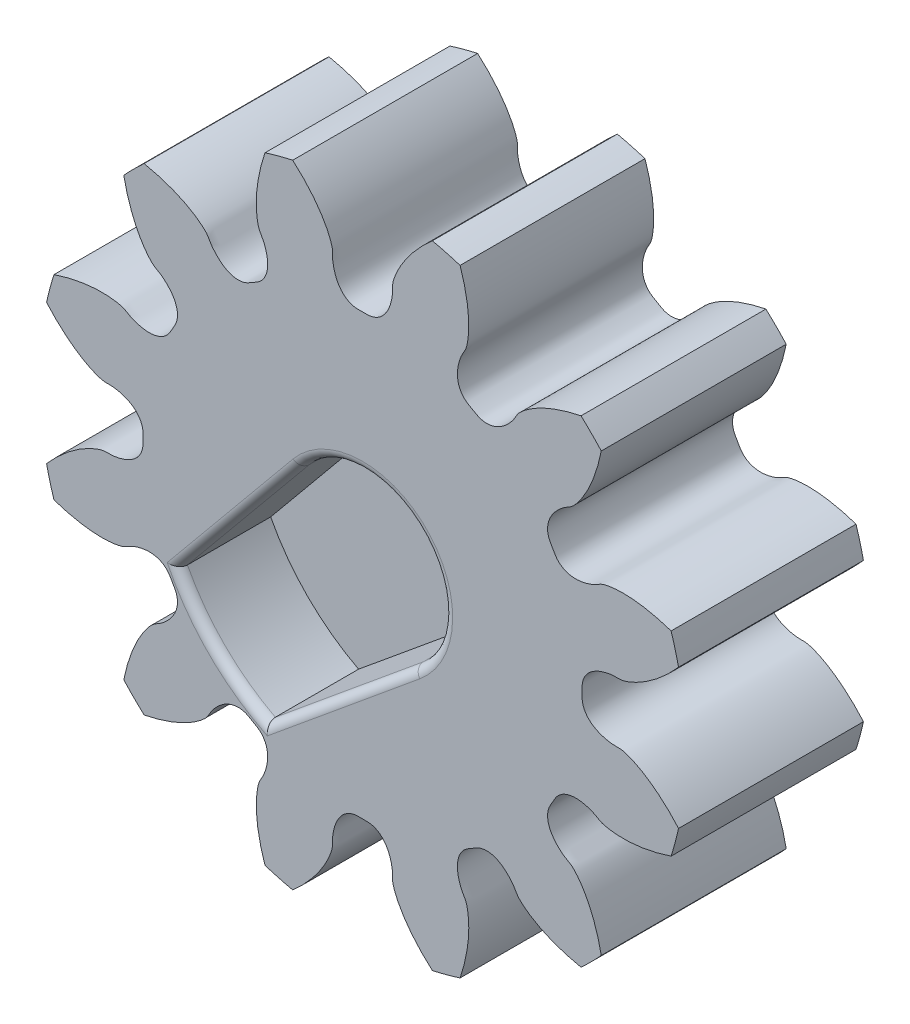
from build123d import *

# Parameters (mm, degrees)
SKETCH_233_W               = 20
SKETCH_233_H               = 13.99999979
CUT_EXTRUDE_402_DEPTH      = 10
PATTERN_CIRCULAR_454_COUNT = 12
CUT_EXTRUDE_1_DEPTH        = 4
SKETCH_2_R                 = 22.983710015
CUT_EXTRUDE_2_DEPTH        = 12
SKETCH_3_R                 = 1
CUT_EXTRUDE_3_DEPTH        = 8
FILLET_1_R                 = 0.4
CUT_EXTRUDE_START          = -1
SKETCH_4_R                 = 3.5
CUT_EXTRUDE_4_DEPTH        = 1


with BuildPart() as part:
    # Sketch 233 → Revolve 260 (revolve)
    with BuildSketch(Plane(origin=(0, 0, 0), x_dir=(0, 0, -1), z_dir=(1, 0, 0)), mode=Mode.PRIVATE) as revolve_260_sk:
        with Locations((0, 6.999999895)):
            Rectangle(SKETCH_233_W, SKETCH_233_H)
    revolve(revolve_260_sk.sketch.rotate(Axis((0, 0, 0), (0, 0, -1)), 90), axis=Axis((0, 0, 0), (0, 0, -1)))

    # Sketch 307 → Cut-Extrude 402 (cut, symmetric)
    with BuildSketch(Plane.XY):
        with BuildLine():
            ThreePointArc((13.751672343, 3.114723392), (14.099999788, 0), (13.751672343, -3.114723392))
            add(Edge.make_bspline(
                [(13.751672343, -3.114723392), (13.621405594, -2.961366383), (13.423168665, -2.744099109), (13.150302893, -2.477714686), (12.955973065, -2.301738692), (12.767351865, -2.143387522), (12.585471133, -2.001970796), (12.411318432, -1.87674583), (12.245834563, -1.766920222), (12.089911307, -1.671655204), (11.944389115, -1.590064993), (11.81005545, -1.521230069), (11.687641583, -1.464165948), (11.577824803, -1.41793324), (11.481214394, -1.381309823), (11.368401777, -1.343822941), (11.139285425, -1.276740863), (10.893805917, -1.309567257), (10.679613247, -1.275365686), (10.5857322, -1.258383462), (10.494653994, -1.237600603), (10.406289124, -1.213539659), (10.320617301, -1.185967837), (10.237597526, -1.154794968), (10.157199405, -1.119828447), (10.079407666, -1.080824203), (10.004240522, -1.037460106), (9.931773934, -0.989331575), (9.862176927, -0.935947305), (9.795758995, -0.876738068), (9.733030125, -0.811086036), (9.674765443, -0.73838774), (9.622069009, -0.658162114), (9.576371784, -0.570212963), (9.539468558, -0.474816546), (9.51299326, -0.37294559), (9.500903465, -0.277168158), (9.495960574, -0.152429996), (9.502886425, 0), (9.495960574, 0.152429996), (9.500903465, 0.277168158), (9.51299326, 0.37294559), (9.539468558, 0.474816546), (9.576371784, 0.570212963), (9.622069009, 0.658162114), (9.674765443, 0.73838774), (9.733030125, 0.811086036), (9.795758995, 0.876738068), (9.862176927, 0.935947305), (9.931773934, 0.989331575), (10.004240522, 1.037460106), (10.079407666, 1.080824203), (10.157199405, 1.119828447), (10.237597526, 1.154794968), (10.320617301, 1.185967837), (10.406289124, 1.213539659), (10.494653994, 1.237600603), (10.5857322, 1.258383462), (10.679613247, 1.275365686), (10.893805917, 1.309567257), (11.139285425, 1.276740863), (11.368401777, 1.343822941), (11.481214394, 1.381309823), (11.577824803, 1.41793324), (11.687641583, 1.464165948), (11.81005545, 1.521230069), (11.944389115, 1.590064993), (12.089911307, 1.671655204), (12.245834563, 1.766920222), (12.411318432, 1.87674583), (12.585471133, 2.001970796), (12.767351865, 2.143387522), (12.955973065, 2.301738692), (13.150302893, 2.477714686), (13.423168665, 2.744099109), (13.621405594, 2.961366383), (13.751672343, 3.114723392)],
                knots=[0, 0, 0, 0, 0.053498046, 0.078135304, 0.101364719, 0.123186291, 0.143600019, 0.162605904, 0.180203946, 0.196394145, 0.2111765, 0.224551012, 0.236517681, 0.247076507, 0.256227489, 0.263970629, 0.278715542, 0.319236256, 0.327882554, 0.336333023, 0.34460309, 0.352710549, 0.36067594, 0.368522978, 0.376279002, 0.383975421, 0.391648082, 0.399337459, 0.407088481, 0.414949717, 0.422971564, 0.431202994, 0.439686492, 0.44845116, 0.457504745, 0.466826485, 0.47636373, 0.483108959, 0.5, 0.516891041, 0.52363627, 0.533173515, 0.542495255, 0.55154884, 0.560313508, 0.568797006, 0.577028436, 0.585050283, 0.592911519, 0.600662541, 0.608351918, 0.616024579, 0.623720998, 0.631477022, 0.63932406, 0.647289451, 0.65539691, 0.663666977, 0.672117446, 0.680763744, 0.721284458, 0.736029371, 0.743772511, 0.752923493, 0.763482319, 0.775448988, 0.7888235, 0.803605855, 0.819796054, 0.837394096, 0.856399981, 0.876813709, 0.898635281, 0.921864696, 0.946501954, 1, 1, 1, 1], degree=3))
        make_face()
    cut_extrude_402 = extrude(amount=CUT_EXTRUDE_402_DEPTH, both=True, mode=Mode.SUBTRACT)

    # Pattern Circular 454: Cut-Extrude 402 ×12 about axis
    pattern_circular_454_axis = Axis((0, 0, 55), (0, 0, -1))
    for i in range(1, PATTERN_CIRCULAR_454_COUNT):
        add(cut_extrude_402.rotate(pattern_circular_454_axis, i * 360 / PATTERN_CIRCULAR_454_COUNT), mode=Mode.SUBTRACT)

    # 草图1 → 切除-拉伸1 (cut)
    with BuildSketch(Plane.XY.offset(10)):
        with BuildLine():
            ThreePointArc((-7.974788498, -4.171660151), (-6.363961031, -6.363961031), (-4.171660151, -7.974788498))
            Line((-4.171660151, -7.974788498), (2.226287024, -2.700675117))
            ThreePointArc((2.226287024, -2.700675117), (2.474873734, 2.474873734), (-2.700675117, 2.226287024))
            Line((-2.700675117, 2.226287024), (-7.974788498, -4.171660151))
        make_face()
    extrude(amount=-CUT_EXTRUDE_1_DEPTH, mode=Mode.SUBTRACT)

    # 草图2 → 切除-拉伸2 (cut)
    with BuildSketch(Plane(origin=(0, 0, -10), x_dir=(-1, 0, 0), z_dir=(0, 0, -1))):
        Circle(SKETCH_2_R)
    extrude(amount=-CUT_EXTRUDE_2_DEPTH, mode=Mode.SUBTRACT)

    # 草图3 → 切除-拉伸3 (cut)
    with BuildSketch(Plane.XY.offset(10)):
        Circle(SKETCH_3_R)
    extrude(amount=-CUT_EXTRUDE_3_DEPTH, mode=Mode.SUBTRACT)

    # 圆角1
    fillet_1_edges = [part.edges().sort_by_distance(p)[0] for p in [
        (-5.337731807, -0.972686564, 10),
        (2.474873734, 2.474873734, 10),
        (-6.363961031, -6.363961031, 10),
        (-0.972686564, -5.337731807, 10),
    ]]
    fillet(fillet_1_edges, radius=FILLET_1_R)

    # 草图4 → 切除-拉伸4 (cut)
    with BuildSketch(Plane(origin=(0, 0, 2), x_dir=(-1, 0, 0), z_dir=(0, 0, -1)).offset(CUT_EXTRUDE_START)):
        Circle(SKETCH_4_R)
    extrude(amount=CUT_EXTRUDE_4_DEPTH, mode=Mode.SUBTRACT)


solid = part.part
